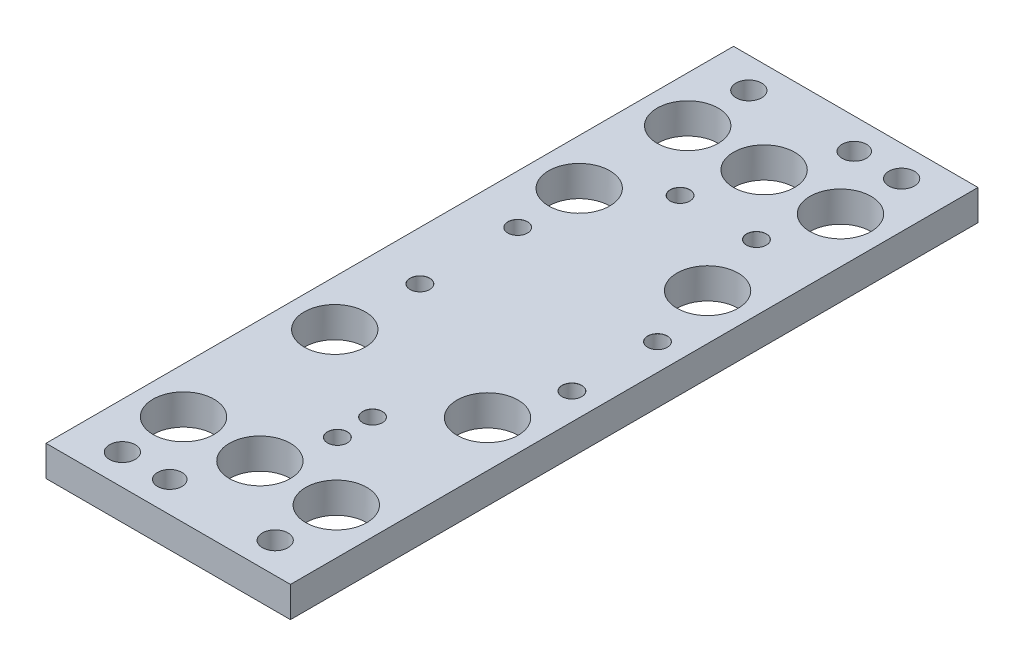
from build123d import *

# Parameters (mm, degrees)
SKETCH1_W                      = 80
SKETCH1_H                      = 225
BOSS_EXTRUDE1_DEPTH            = 10
CUT_EXTRUDE1_REACH             = 121.818
SKETCH2_R                      = 10
M8_CLEARANCE_HOLE1_D           = 8.4
F_8_0MM_DOWEL_HOLE1_D          = 8
M6_CLEARANCE_HOLE1_D           = 6.4
M6_CLEARANCE_HOLE1_CSINK_D     = 6.45
M6_CLEARANCE_HOLE1_CSINK_ANGLE = 90


with BuildPart() as part:
    # Sketch1 → Boss-Extrude1 (new body)
    with BuildSketch(Plane(origin=(0, 0, 0), x_dir=(1, 0, 0), z_dir=(0, 1, 0))):
        Rectangle(SKETCH1_W, SKETCH1_H)
    extrude(amount=-BOSS_EXTRUDE1_DEPTH)

    # Sketch2 → Cut-Extrude1 (cut, up to next)
    with BuildSketch(Plane(origin=(0, 0, 0), x_dir=(1, 0, 0), z_dir=(0, 1, 0)), mode=Mode.PRIVATE) as cut_extrude1_sk1:
        with Locations(Location((25, -82.5, 0), (0, 0, 270))):
            Circle(SKETCH2_R)
    cut_extrude1_tool1 = extrude(cut_extrude1_sk1.sketch, amount=-CUT_EXTRUDE1_REACH, mode=Mode.PRIVATE) & part.part
    # Sketch2 → Cut-Extrude1 (cut, up to next)
    with BuildSketch(Plane(origin=(0, 0, 0), x_dir=(1, 0, 0), z_dir=(0, 1, 0)), mode=Mode.PRIVATE) as cut_extrude1_sk2:
        with Locations(Location((0, -82.5, 0), (0, 0, 270))):
            Circle(SKETCH2_R)
    cut_extrude1_tool2 = extrude(cut_extrude1_sk2.sketch, amount=-CUT_EXTRUDE1_REACH, mode=Mode.PRIVATE) & part.part
    # Sketch2 → Cut-Extrude1 (cut, up to next)
    with BuildSketch(Plane(origin=(0, 0, 0), x_dir=(1, 0, 0), z_dir=(0, 1, 0)), mode=Mode.PRIVATE) as cut_extrude1_sk3:
        with Locations(Location((-25, -82.5, 0), (0, 0, 270))):
            Circle(SKETCH2_R)
    cut_extrude1_tool3 = extrude(cut_extrude1_sk3.sketch, amount=-CUT_EXTRUDE1_REACH, mode=Mode.PRIVATE) & part.part
    # Sketch2 → Cut-Extrude1 (cut, up to next)
    with BuildSketch(Plane(origin=(0, 0, 0), x_dir=(1, 0, 0), z_dir=(0, 1, 0)), mode=Mode.PRIVATE) as cut_extrude1_sk4:
        with Locations(Location((25, -33, 0), (0, 0, 270))):
            Circle(SKETCH2_R)
    cut_extrude1_tool4 = extrude(cut_extrude1_sk4.sketch, amount=-CUT_EXTRUDE1_REACH, mode=Mode.PRIVATE) & part.part
    # Sketch2 → Cut-Extrude1 (cut, up to next)
    with BuildSketch(Plane(origin=(0, 0, 0), x_dir=(1, 0, 0), z_dir=(0, 1, 0)), mode=Mode.PRIVATE) as cut_extrude1_sk5:
        with Locations(Location((-25, -33, 0), (0, 0, 270))):
            Circle(SKETCH2_R)
    cut_extrude1_tool5 = extrude(cut_extrude1_sk5.sketch, amount=-CUT_EXTRUDE1_REACH, mode=Mode.PRIVATE) & part.part
    # Sketch2 → Cut-Extrude1 (cut, up to next)
    with BuildSketch(Plane(origin=(0, 0, 0), x_dir=(1, 0, 0), z_dir=(0, 1, 0)), mode=Mode.PRIVATE) as cut_extrude1_sk6:
        with Locations(Location((25, 39, 0), (0, 0, 270))):
            Circle(SKETCH2_R)
    cut_extrude1_tool6 = extrude(cut_extrude1_sk6.sketch, amount=-CUT_EXTRUDE1_REACH, mode=Mode.PRIVATE) & part.part
    # Sketch2 → Cut-Extrude1 (cut, up to next)
    with BuildSketch(Plane(origin=(0, 0, 0), x_dir=(1, 0, 0), z_dir=(0, 1, 0)), mode=Mode.PRIVATE) as cut_extrude1_sk7:
        with Locations(Location((-25, 47, 0), (0, 0, 270))):
            Circle(SKETCH2_R)
    cut_extrude1_tool7 = extrude(cut_extrude1_sk7.sketch, amount=-CUT_EXTRUDE1_REACH, mode=Mode.PRIVATE) & part.part
    # Sketch2 → Cut-Extrude1 (cut, up to next)
    with BuildSketch(Plane(origin=(0, 0, 0), x_dir=(1, 0, 0), z_dir=(0, 1, 0)), mode=Mode.PRIVATE) as cut_extrude1_sk8:
        with Locations(Location((-25, 82.5, 0), (0, 0, 270))):
            Circle(SKETCH2_R)
    cut_extrude1_tool8 = extrude(cut_extrude1_sk8.sketch, amount=-CUT_EXTRUDE1_REACH, mode=Mode.PRIVATE) & part.part
    # Sketch2 → Cut-Extrude1 (cut, up to next)
    with BuildSketch(Plane(origin=(0, 0, 0), x_dir=(1, 0, 0), z_dir=(0, 1, 0)), mode=Mode.PRIVATE) as cut_extrude1_sk9:
        with Locations(Location((0, 82.5, 0), (0, 0, 270))):
            Circle(SKETCH2_R)
    cut_extrude1_tool9 = extrude(cut_extrude1_sk9.sketch, amount=-CUT_EXTRUDE1_REACH, mode=Mode.PRIVATE) & part.part
    # Sketch2 → Cut-Extrude1 (cut, up to next)
    with BuildSketch(Plane(origin=(0, 0, 0), x_dir=(1, 0, 0), z_dir=(0, 1, 0)), mode=Mode.PRIVATE) as cut_extrude1_sk10:
        with Locations(Location((25, 82.5, 0), (0, 0, 270))):
            Circle(SKETCH2_R)
    cut_extrude1_tool10 = extrude(cut_extrude1_sk10.sketch, amount=-CUT_EXTRUDE1_REACH, mode=Mode.PRIVATE) & part.part
    add(cut_extrude1_tool1.solids().sort_by_distance((25, 0, 82.5))[0], mode=Mode.SUBTRACT)
    add(cut_extrude1_tool2.solids().sort_by_distance((0, 0, 82.5))[0], mode=Mode.SUBTRACT)
    add(cut_extrude1_tool3.solids().sort_by_distance((-25, 0, 82.5))[0], mode=Mode.SUBTRACT)
    add(cut_extrude1_tool4.solids().sort_by_distance((25, 0, 33))[0], mode=Mode.SUBTRACT)
    add(cut_extrude1_tool5.solids().sort_by_distance((-25, 0, 33))[0], mode=Mode.SUBTRACT)
    add(cut_extrude1_tool6.solids().sort_by_distance((25, 0, -39))[0], mode=Mode.SUBTRACT)
    add(cut_extrude1_tool7.solids().sort_by_distance((-25, 0, -47))[0], mode=Mode.SUBTRACT)
    add(cut_extrude1_tool8.solids().sort_by_distance((-25, 0, -82.5))[0], mode=Mode.SUBTRACT)
    add(cut_extrude1_tool9.solids().sort_by_distance((0, 0, -82.5))[0], mode=Mode.SUBTRACT)
    add(cut_extrude1_tool10.solids().sort_by_distance((25, 0, -82.5))[0], mode=Mode.SUBTRACT)

    # M8 Clearance Hole1 (through all)
    with Locations(Plane(origin=(0, 0, 0), x_dir=(1, 0, 0), z_dir=(0, 1, 0))):
        with Locations((25, -102.5), (-25, -102.5), (25, 102.5), (-25, 102.5)):
            Hole(M8_CLEARANCE_HOLE1_D / 2)

    # Ø8.0mm Dowel Hole1 (through all)
    with Locations(Plane(origin=(0, 0, 0), x_dir=(1, 0, 0), z_dir=(0, 1, 0))):
        with Locations((-9.5, -102.5), (9.5, 102.5)):
            Hole(F_8_0MM_DOWEL_HOLE1_D / 2)

    # M6 Clearance Hole1 (through all)
    with Locations(Plane(origin=(0, 0, 0), x_dir=(1, 0, 0), z_dir=(0, 1, 0))):
        with Locations((-24, -6.14), (-24, 25.86), (31.25, -11.64), (31.25, 16.36), (18.5, 61.5), (-6.5, 61.5), (6, -51.64), (6, -63.14)):
            CounterSinkHole(M6_CLEARANCE_HOLE1_D / 2, M6_CLEARANCE_HOLE1_CSINK_D / 2, counter_sink_angle=M6_CLEARANCE_HOLE1_CSINK_ANGLE)


solid = part.part
